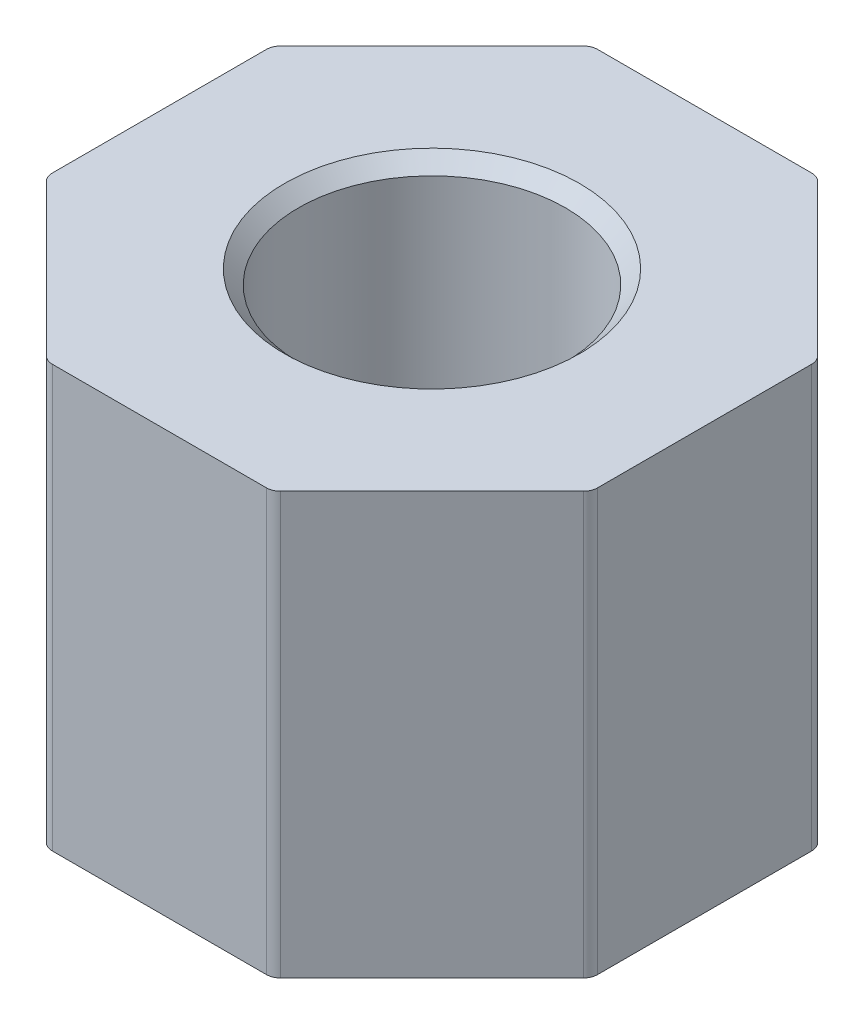
from build123d import *

# Parameters (mm, degrees)
SCHIZZO1_R                   = 9.5
ESTRUSIONE_ESTRUSIONE1_DEPTH = 30
RACCORDO1_R                  = 1
SMUSSO1_SIZE                 = 1


with BuildPart() as part:
    # Schizzo1 → Estrusione-Estrusione1 (new body)
    with BuildSketch(Plane(origin=(0, 0, 0), x_dir=(1, 0, 0), z_dir=(0, 1, 0))):
        Polygon((-19.401470183, 8.03635208), (-8.03635208, 19.401470183), (8.03635208, 19.401470183), (19.401470183, 8.03635208), (19.401470183, -8.03635208), (8.03635208, -19.401470183), (-8.03635208, -19.401470183), (-19.401470183, -8.03635208), align=None)
        with Locations(Location((0, 0, 0), (0, 0, 270))):
            Circle(SCHIZZO1_R, mode=Mode.SUBTRACT)
    extrude(amount=ESTRUSIONE_ESTRUSIONE1_DEPTH)

    # Raccordo1
    raccordo1_edges = [part.edges().sort_by_distance(p)[0] for p in [
        (-19.401470183, 15, -8.03635208),
        (-8.03635208, 15, -19.401470183),
        (8.03635208, 15, -19.401470183),
        (19.401470183, 15, -8.03635208),
        (19.401470183, 15, 8.03635208),
        (8.03635208, 15, 19.401470183),
        (-8.03635208, 15, 19.401470183),
        (-19.401470183, 15, 8.03635208),
    ]]
    fillet(raccordo1_edges, radius=RACCORDO1_R)

    # Smusso1
    smusso1_edges = [part.edges().sort_by_distance(p)[0] for p in [
        (0, 0, -9.5),
        (0, 30, -9.5),
    ]]
    chamfer(smusso1_edges, length=SMUSSO1_SIZE)


solid = part.part
